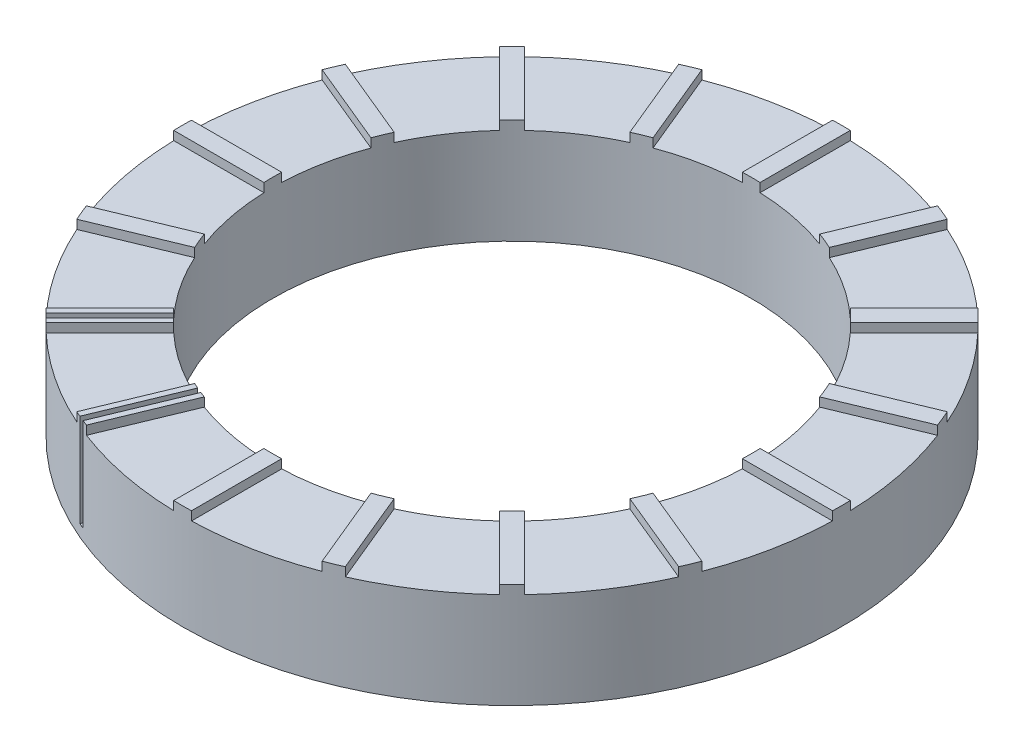
from build123d import *
from build123d.topology import SkipClean

# Parameters (mm, degrees)
SKETCH1_R           = 22.3
SKETCH1_R_2         = 16.2
BOSS_EXTRUDE1_DEPTH = 6.5
BOSS_EXTRUDE2_DEPTH = 0.6
CIRPATTERN1_COUNT   = 16
CUT_EXTRUDE1_START  = -6.3
CUT_EXTRUDE1_DEPTH  = 6.3


with BuildPart() as part:
    # Sketch1 → Boss-Extrude1 (new body)
    with BuildSketch(Plane(origin=(0, 0, 0), x_dir=(1, 0, 0), z_dir=(0, 1, 0))):
        with Locations(Location((0, 0, 0), (0, 0, 90))):
            Circle(SKETCH1_R)
        with Locations(Location((0, 0, 0), (0, 0, 90))):
            Circle(SKETCH1_R_2, mode=Mode.SUBTRACT)
    extrude(amount=BOSS_EXTRUDE1_DEPTH)

    # Sketch2 → Boss-Extrude2 (add)
    with BuildSketch(Plane(origin=(0, 6.5, 0), x_dir=(1, 0, 0), z_dir=(0, 1, 0))):
        with BuildLine():
            ThreePointArc((0.6, 22.29192679), (0, 22.3), (-0.6, 22.29192679))
            Line((-0.6, 22.29192679), (-0.6, 16.188885076))
            ThreePointArc((-0.6, 16.188885076), (0, 16.2), (0.6, 16.188885076))
            Line((0.6, 16.188885076), (0.6, 22.29192679))
        make_face()
    boss_extrude2 = extrude(amount=BOSS_EXTRUDE2_DEPTH)

    # CirPattern1: Boss-Extrude2 ×16 about axis
    with SkipClean():  # the faces are left unmerged after this step: merging them gives an invalid solid
        cirpattern1_axis = Axis((0, 0, 0), (0, 1, 0))
        for i in range(1, CIRPATTERN1_COUNT):
            add(boss_extrude2.rotate(cirpattern1_axis, i * 360 / CIRPATTERN1_COUNT))

    # Sketch3 → Cut-Extrude1 (cut)
    with SkipClean():  # the faces are left unmerged after this step: merging them gives an invalid solid
        with BuildSketch(Plane(origin=(0, 7.1, 0), x_dir=(1, 0, 0), z_dir=(0, 1, 0)).offset(CUT_EXTRUDE1_START)):
            with BuildLine():
                Line((-15.909268387, -15.626425675), (-11.595678207, -11.312835494))
                ThreePointArc((-11.595678207, -11.312835494), (-11.455129855, -11.455129855), (-11.312835494, -11.595678207))
                Line((-11.312835494, -11.595678207), (-15.626425675, -15.909268387))
                ThreePointArc((-15.626425675, -15.909268387), (-15.76848122, -15.76848122), (-15.909268387, -15.626425675))
            make_face()
            with BuildLine():
                Line((-6.014223231, -15.042244478), (-8.348721414, -20.678221653))
                ThreePointArc((-8.348721414, -20.678221653), (-8.533840542, -20.602513575), (-8.718273228, -20.52514828))
                Line((-8.718273228, -20.52514828), (-6.383775044, -14.889171105))
                ThreePointArc((-6.383775044, -14.889171105), (-6.199471604, -14.966848427), (-6.014223231, -15.042244478))
            make_face()
        extrude(amount=CUT_EXTRUDE1_DEPTH, mode=Mode.SUBTRACT)


solid = part.part
